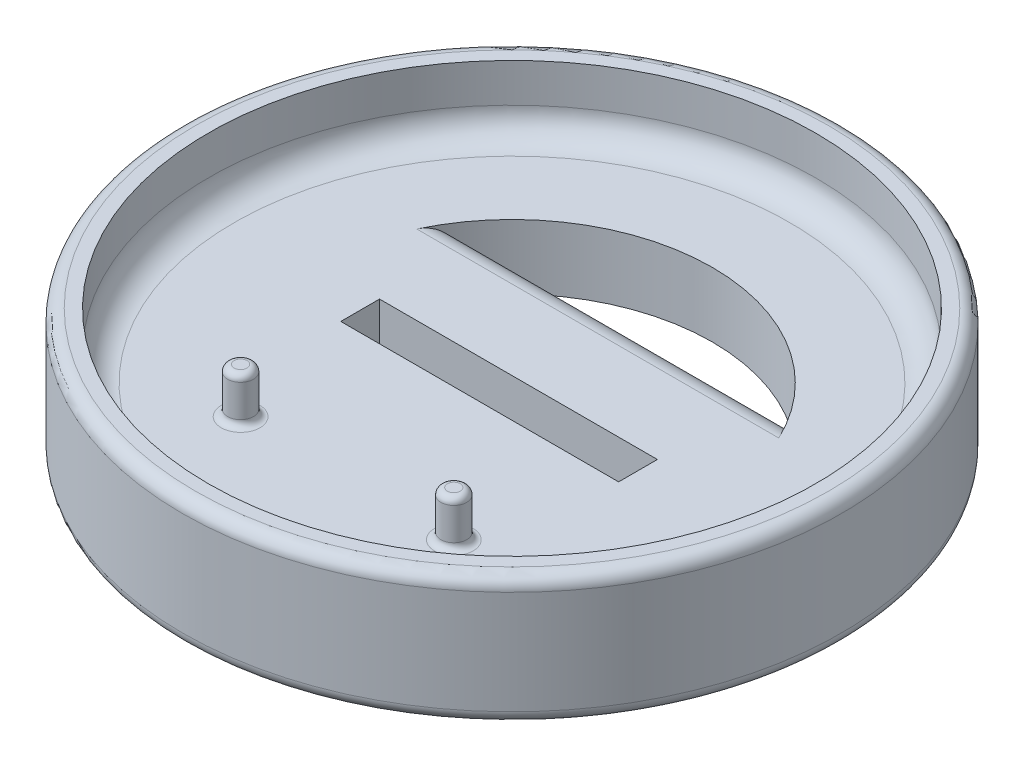
from build123d import *

# Parameters (mm, degrees)
SKETCH1_R           = 25.500000000000004
SKETCH1_R_2         = 15.5
BOSS_EXTRUDE1_DEPTH = 5
SKETCH2_R           = 25.5
SKETCH2_R_2         = 23.500000000000004
BOSS_EXTRUDE2_DEPTH = 5
FILLET1_R           = 2
CUT_EXTRUDE1_DEPTH  = 5
BOSS_EXTRUDE3_DEPTH = 3.5
FILLET2_R           = 0.5
FILLET3_R           = 1


with BuildPart() as part:
    # Sketch1 → Boss-Extrude1 (new body)
    # profile 1 of 2: a face of its own
    with BuildSketch(Plane(origin=(0, 0, 0), x_dir=(1, 0, 0), z_dir=(0, 1, 0))):
        with Locations(Location((0, 0, 0), (0, 0, 270))):
            Circle(SKETCH1_R)
        Circle(SKETCH1_R_2, mode=Mode.SUBTRACT)
    # profile 2 of 2: a face of its own
    with BuildSketch(Plane(origin=(0, 0, 0), x_dir=(1, 0, 0), z_dir=(0, 1, 0))):
        with BuildLine():
            Line((12.871816372215148, 8.635180558620302), (-12.871816372215148, 8.635180558620302))
            ThreePointArc((-12.871816372215148, 8.635180558620304), (-4.51313894261329, -14.828404394427182), (15.5, -3.8e-15))
            ThreePointArc((15.5, 0), (14.828404394427182, 4.513138942613289), (12.871816372215148, 8.635180558620304))
        make_face()
    extrude(amount=BOSS_EXTRUDE1_DEPTH)

    # Sketch2 → Boss-Extrude2 (add)
    with BuildSketch(Plane(origin=(0, 5, 0), x_dir=(1, 0, 0), z_dir=(0, 1, 0))):
        with Locations(Location((0, 0, 0), (0, 0, 270))):
            Circle(SKETCH2_R)
        with Locations(Location((0, 0, 0), (0, 0, 270))):
            Circle(SKETCH2_R_2, mode=Mode.SUBTRACT)
    extrude(amount=BOSS_EXTRUDE2_DEPTH)

    # Fillet1
    fillet1_edges = [part.edges().sort_by_distance(p)[0] for p in [
        (1.763e-14, 5, -23.500000000000004),
        (0, 0, -8.635180558620302),
        (0, 5, -8.635180558620302),
    ]]
    fillet(fillet1_edges, radius=FILLET1_R)

    # Sketch3 → Cut-Extrude1 (cut)
    with BuildSketch(Plane(origin=(0, 5, 0), x_dir=(1, 0, 0), z_dir=(0, 1, 0))):
        Polygon((-10.75, -2.5000000000000018), (10.75, -2.499999999999999), (10.75, 0.5000000000000018), (-10.75, 0.4999999999999983), align=None)
    extrude(amount=-CUT_EXTRUDE1_DEPTH, mode=Mode.SUBTRACT)

    # Sketch5 → Boss-Extrude3 (add)
    with BuildSketch(Plane(origin=(0, 5, 0), x_dir=(1, 0, 0), z_dir=(0, 1, 0))):
        with BuildLine():
            ThreePointArc((8.250000000000018, -13.750000000000004), (8.957106781186555, -13.457106781186544), (9.250000000000002, -12.750000000000002))
            Line((9.250000000000002, -12.750000000000002), (8.25, -12.750000000000002))
            Line((8.25, -12.750000000000002), (8.25, -13.750000000000004))
        make_face()
        with BuildLine():
            Line((8.25, -12.750000000000002), (9.250000000000002, -12.750000000000002))
            ThreePointArc((9.250000000000002, -12.750000000000002), (7.542893218813445, -12.04289321881346), (8.250000000000018, -13.750000000000004))
            Line((8.25, -13.750000000000004), (8.25, -12.750000000000002))
        make_face()
        with BuildLine():
            ThreePointArc((-7.2499999999999964, -12.750000000000002), (-8.249999999999996, -11.750000000000002), (-9.249999999999996, -12.750000000000002))
            Line((-9.249999999999996, -12.750000000000002), (-8.249999999999996, -12.750000000000002))
            Line((-8.249999999999996, -12.750000000000002), (-8.249999999999996, -13.750000000000002))
            ThreePointArc((-8.249999999999979, -13.750000000000002), (-7.542893218813443, -13.457106781186543), (-7.2499999999999964, -12.750000000000002))
        make_face()
        with BuildLine():
            Line((-8.249999999999996, -12.750000000000002), (-9.249999999999996, -12.750000000000002))
            ThreePointArc((-9.249999999999996, -12.750000000000002), (-8.957106781186537, -13.457106781186555), (-8.249999999999979, -13.750000000000002))
            Line((-8.249999999999996, -13.750000000000002), (-8.249999999999996, -12.750000000000002))
        make_face()
    extrude(amount=BOSS_EXTRUDE3_DEPTH)

    # Fillet2
    fillet2_edges = [part.edges().sort_by_distance(p)[0] for p in [
        (8.249999999999986, 5, 11.750000000000002),
        (8.249999999999982, 8.5, 11.749999999999998),
        (-7.249999999999996, 5, 12.749999999999998),
        (-7.2499999999999964, 8.5, 12.750000000000002),
    ]]
    fillet(fillet2_edges, radius=FILLET2_R)

    # Fillet3
    fillet3_edges = [part.edges().sort_by_distance(p)[0] for p in [
        (7.81e-15, 10, -25.5),
        (7.81e-15, 0, -25.500000000000004),
    ]]
    fillet(fillet3_edges, radius=FILLET3_R)


solid = part.part
